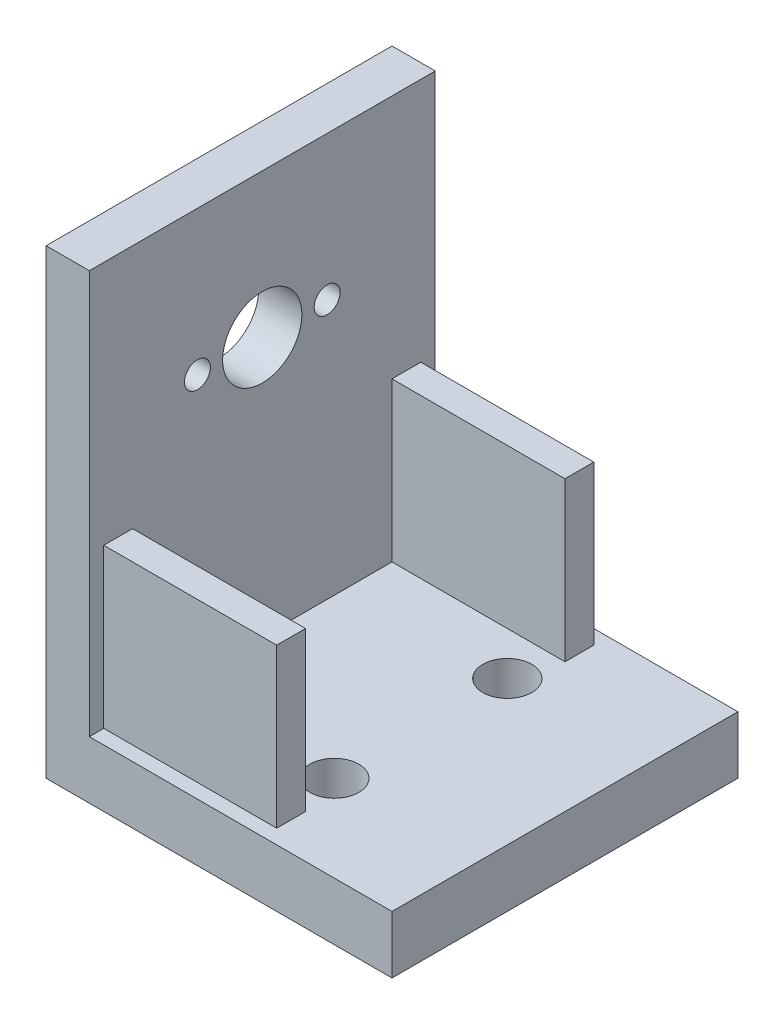
from build123d import *

# Parameters (mm, degrees)
SKETCH1_W           = 24
SKETCH1_H           = 24
BOSS_EXTRUDE1_DEPTH = 4
SKETCH2_W           = 3
SKETCH2_H           = 24
BOSS_EXTRUDE2_DEPTH = 28
SKETCH3_R           = 2.75
SKETCH3_R_2         = 0.9
CUT_EXTRUDE1_DEPTH  = 3
SKETCH4_R           = 1.7
CUT_EXTRUDE2_DEPTH  = 4
SKETCH6_W           = 12
SKETCH6_H           = 2
BOSS_EXTRUDE3_DEPTH = 11


with BuildPart() as part:
    # Sketch1 → Boss-Extrude1 (new body)
    with BuildSketch(Plane(origin=(0, 0, 0), x_dir=(1, 0, 0), z_dir=(0, 1, 0))):
        Rectangle(SKETCH1_W, SKETCH1_H)
    extrude(amount=BOSS_EXTRUDE1_DEPTH)

    # Sketch2 → Boss-Extrude2 (add)
    with BuildSketch(Plane(origin=(0, 4, 0), x_dir=(1, 0, 0), z_dir=(0, 1, 0))):
        with Locations((-10.5, 0)):
            Rectangle(SKETCH2_W, SKETCH2_H)
    extrude(amount=BOSS_EXTRUDE2_DEPTH)

    # Sketch3 → Cut-Extrude1 (cut)
    with BuildSketch(Plane(origin=(-9, 0, 0), x_dir=(0, 0, -1), z_dir=(1, 0, 0))):
        with Locations((0, 22)):
            Circle(SKETCH3_R)
        with Locations((4.5, 22)):
            Circle(SKETCH3_R_2)
        with Locations((-4.5, 22)):
            Circle(SKETCH3_R_2)
    extrude(amount=-CUT_EXTRUDE1_DEPTH, mode=Mode.SUBTRACT)

    # Sketch4 → Cut-Extrude2 (cut)
    with BuildSketch(Plane(origin=(0, 4, 0), x_dir=(1, 0, 0), z_dir=(0, 1, 0))):
        with Locations(Location((2, 6, 0), (0, 0, 270))):
            Circle(SKETCH4_R)
        with Locations(Location((2, -6, 0), (0, 0, 270))):
            Circle(SKETCH4_R)
    extrude(amount=-CUT_EXTRUDE2_DEPTH, mode=Mode.SUBTRACT)

    # Sketch6 → Boss-Extrude3 (add)
    with BuildSketch(Plane(origin=(0, 4, 0), x_dir=(1, 0, 0), z_dir=(0, 1, 0))):
        with Locations((-3, -10)):
            Rectangle(SKETCH6_W, SKETCH6_H)
        with Locations((-3, 10)):
            Rectangle(SKETCH6_W, SKETCH6_H)
    extrude(amount=BOSS_EXTRUDE3_DEPTH)


solid = part.part
